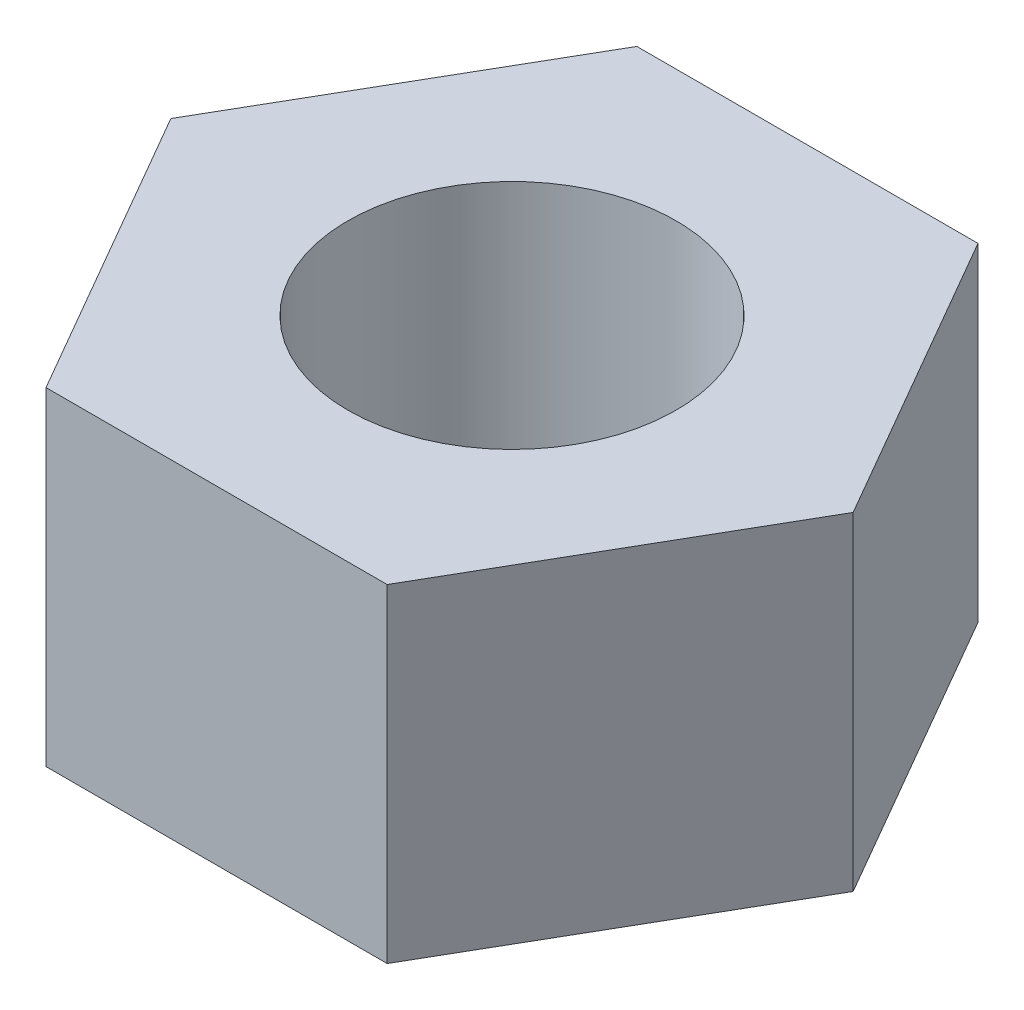
from build123d import *

# Parameters (mm, degrees)
SKETCH1_R           = 5
BOSS_EXTRUDE1_DEPTH = 5


with BuildPart() as part:
    # Sketch1 → Boss-Extrude1 (new, symmetric)
    with BuildSketch(Plane(origin=(0, 0, 0), x_dir=(1, 0, 0), z_dir=(0, 1, 0))):
        Polygon((5.196152423, 9), (-5.196152423, 9), (-10.392304845, 0), (-5.196152423, -9), (5.196152423, -9), (10.392304845, 0), align=None)
        with Locations(Location((0, 0, 0), (0, 0, 270))):
            Circle(SKETCH1_R, mode=Mode.SUBTRACT)
    extrude(amount=BOSS_EXTRUDE1_DEPTH, both=True)


solid = part.part
